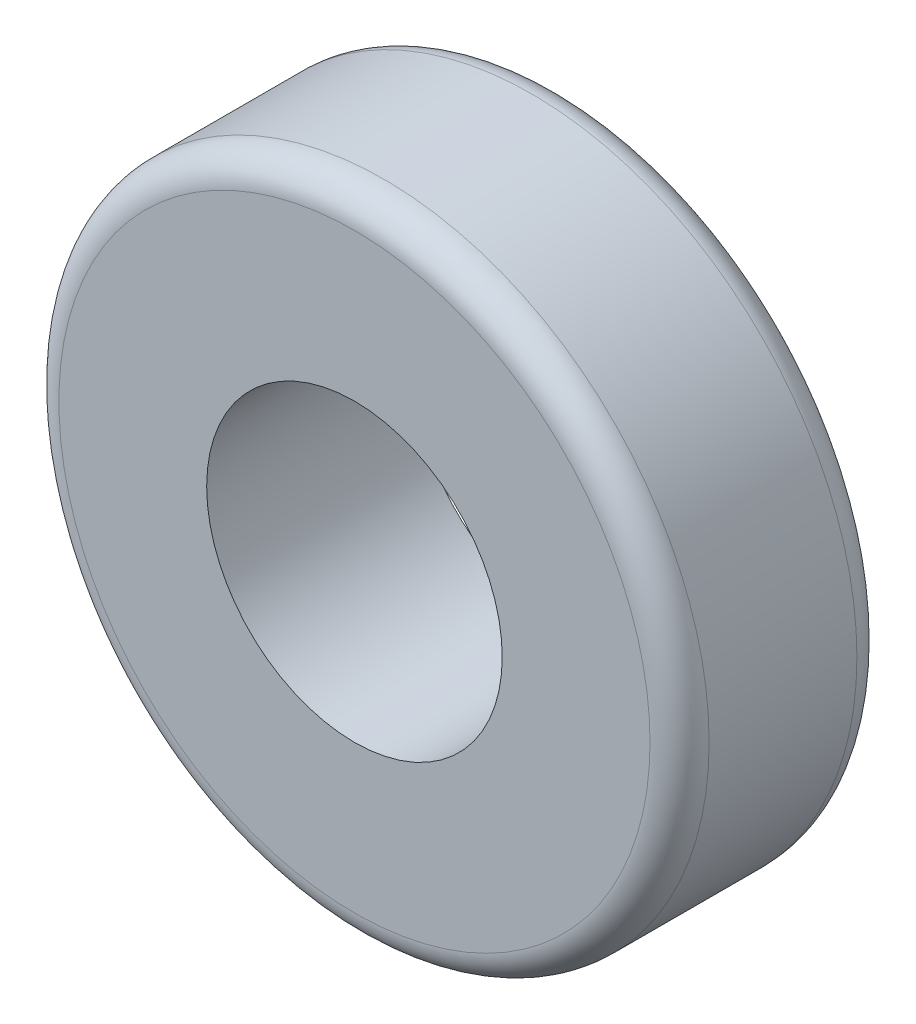
from build123d import *

# Parameters (mm, degrees)
CROQUIS1_R              = 11
CROQUIS1_R_2            = 5
SALIENTE_EXTRUIR1_DEPTH = 7
REDONDEO1_R             = 1


with BuildPart() as part:
    # Croquis1 → Saliente-Extruir1 (new body)
    with BuildSketch(Plane.XY):
        Circle(CROQUIS1_R)
        Circle(CROQUIS1_R_2, mode=Mode.SUBTRACT)
    extrude(amount=SALIENTE_EXTRUIR1_DEPTH)

    # Redondeo1
    redondeo1_edges = [part.edges().sort_by_distance(p)[0] for p in [
        (-11, 0, 0),
        (-11, 0, 7),
    ]]
    fillet(redondeo1_edges, radius=REDONDEO1_R)


solid = part.part
